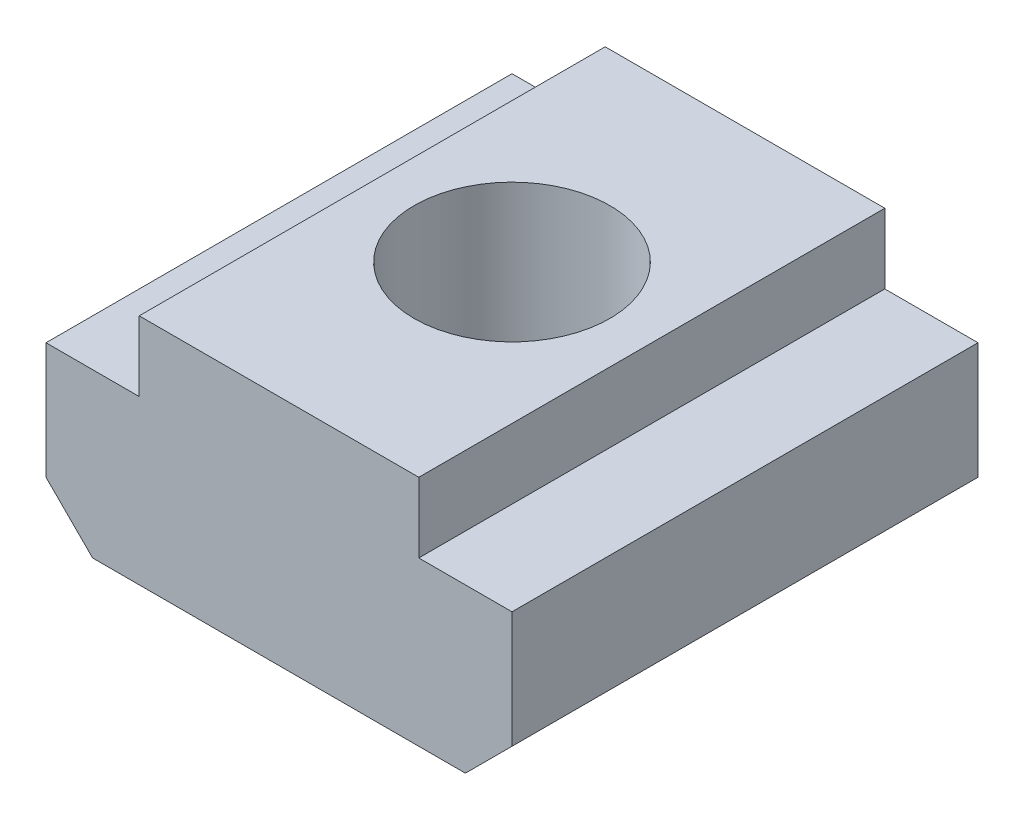
from build123d import *

# Parameters (mm, degrees)
BOSS_EXTRUDE1_DEPTH   = 10
M5X0_8_TAPPED_HOLE1_D = 4.2


with BuildPart() as part:
    # Sketch1 → Boss-Extrude1 (new body)
    with BuildSketch(Plane.XY):
        Polygon((-4, 0), (4, 0), (5, 1), (5, 3.5), (3, 3.5), (3, 5), (-3, 5), (-3, 3.5), (-5, 3.5), (-5, 1), align=None)
    extrude(amount=BOSS_EXTRUDE1_DEPTH)

    # M5x0.8 Tapped Hole1 (through all)
    with Locations(Plane(origin=(0, 5, 0), x_dir=(1, 0, 0), z_dir=(0, 1, 0))):
        with Locations((0, -5)):
            Hole(M5X0_8_TAPPED_HOLE1_D / 2)


solid = part.part
